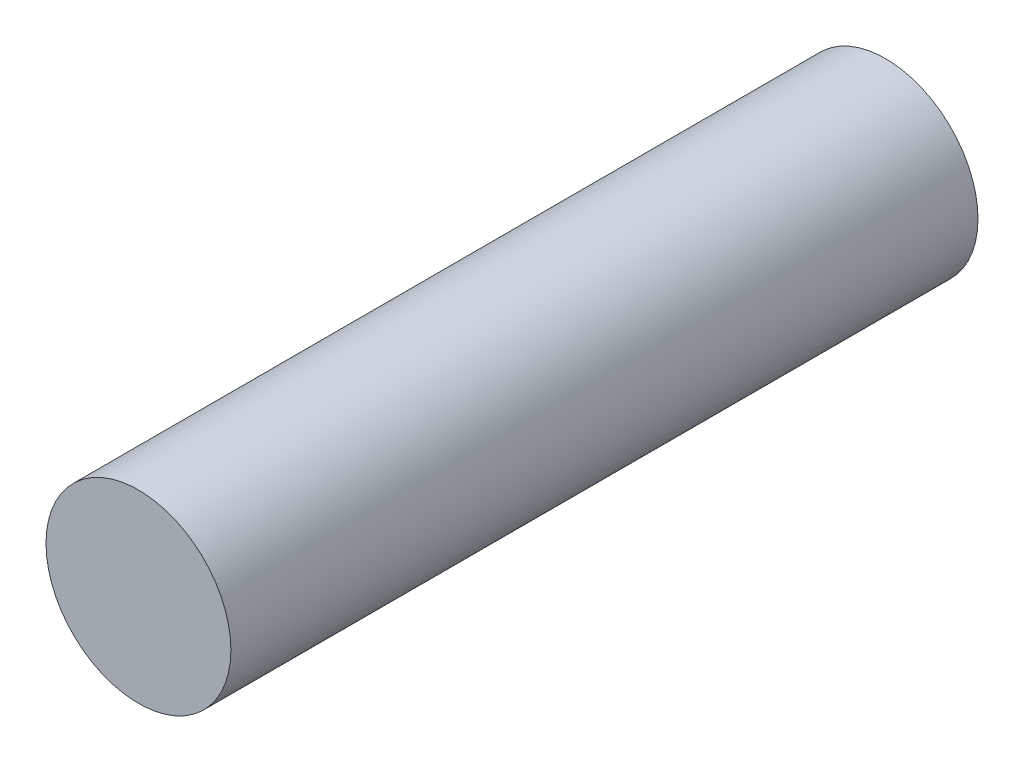
from build123d import *

# Parameters (mm, degrees)
SKETCH2_R           = 2.475
BOSS_EXTRUDE1_DEPTH = 20


with BuildPart() as part:
    # Sketch2 → Boss-Extrude1 (new body)
    with BuildSketch(Plane.XY):
        with Locations((1.91414546, -1.568971688)):
            Circle(SKETCH2_R)
    extrude(amount=BOSS_EXTRUDE1_DEPTH)


solid = part.part
